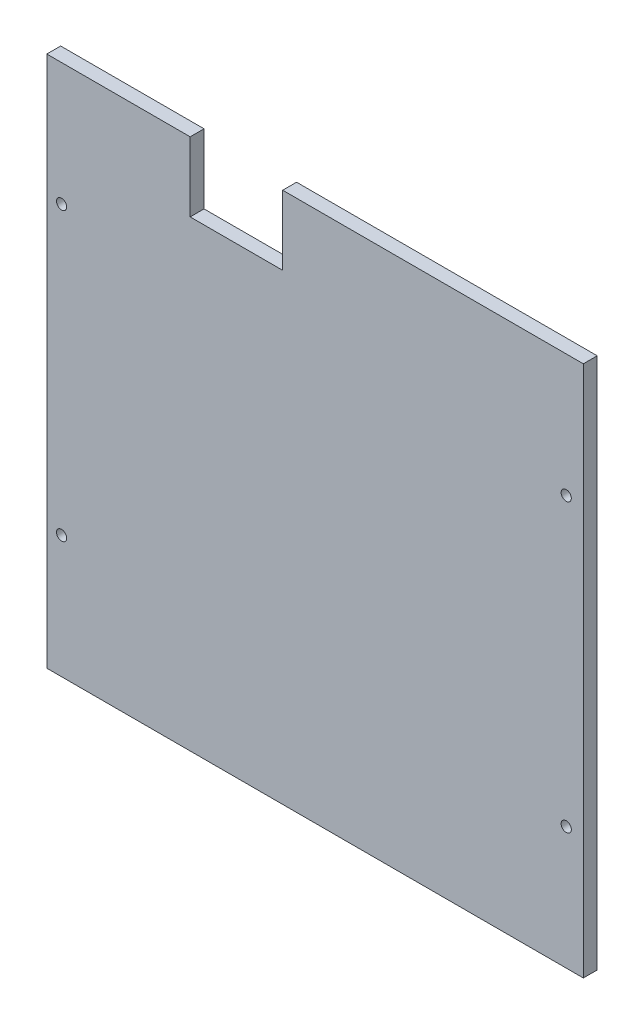
from build123d import *

# Parameters (mm, degrees)
SKETCH1_R           = 2.2
BOSS_EXTRUDE1_DEPTH = 6


with BuildPart() as part:
    # Sketch1 → Boss-Extrude1 (new body)
    with BuildSketch(Plane.XY.offset(6)):
        Polygon((-54, 85), (-54, 115), (-116, 115), (-116, -115), (116, -115), (116, 115), (-14, 115), (-14, 85), align=None)
        with Locations(Location((-109.6, 62, 0), (0, 0, 180))):
            Circle(SKETCH1_R, mode=Mode.SUBTRACT)
        with Locations(Location((108.6, -62, 0), (0, 0, 180))):
            Circle(SKETCH1_R, mode=Mode.SUBTRACT)
        with Locations(Location((108.6, 62, 0), (0, 0, 180))):
            Circle(SKETCH1_R, mode=Mode.SUBTRACT)
        with Locations(Location((-109.6, -62, 0), (0, 0, 180))):
            Circle(SKETCH1_R, mode=Mode.SUBTRACT)
    extrude(amount=-BOSS_EXTRUDE1_DEPTH)


solid = part.part
